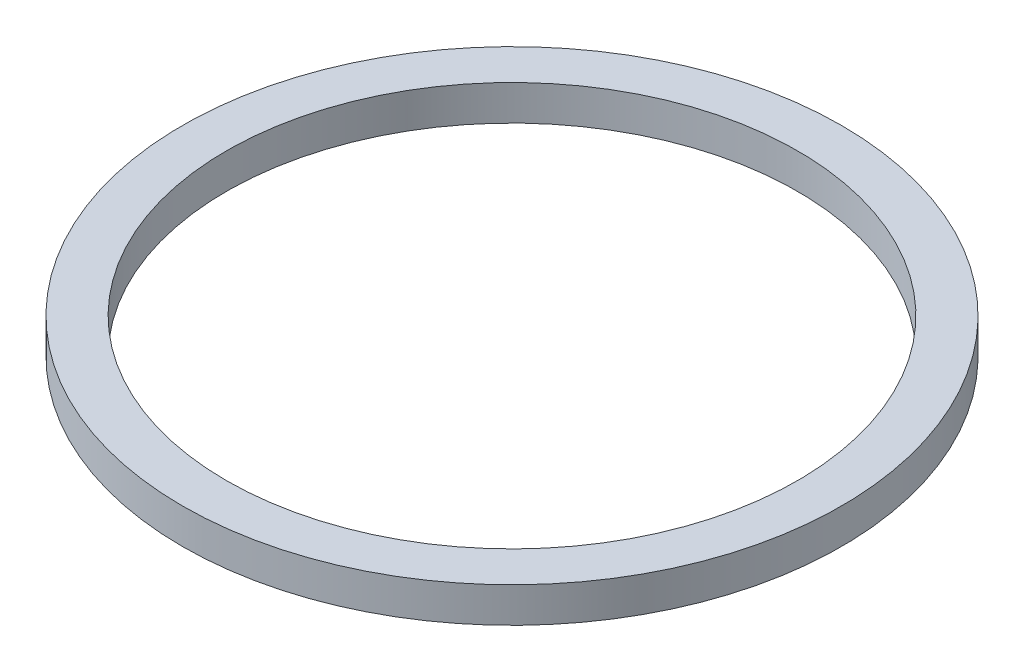
from build123d import *

# Parameters (mm, degrees)
SKETCH1_R           = 23.8125
SKETCH1_R_2         = 20.6375
BOSS_EXTRUDE1_DEPTH = 2.54


with BuildPart() as part:
    # Sketch1 → Boss-Extrude1 (new body)
    with BuildSketch(Plane(origin=(0, 0, 0), x_dir=(1, 0, 0), z_dir=(0, 1, 0))):
        with Locations(Location((0, 0, 0), (0, 0, 270))):
            Circle(SKETCH1_R)
        with Locations(Location((0, 0, 0), (0, 0, 270))):
            Circle(SKETCH1_R_2, mode=Mode.SUBTRACT)
    extrude(amount=BOSS_EXTRUDE1_DEPTH)


solid = part.part
